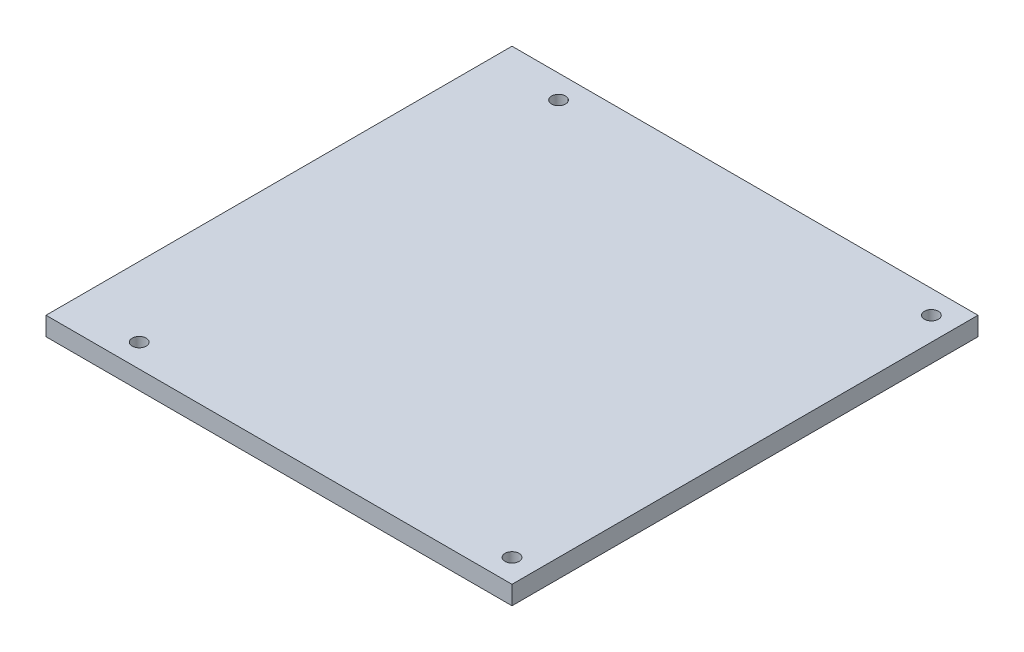
from build123d import *

# Parameters (mm, degrees)
CROQUIS1_W              = 100
CROQUIS1_H              = 100
SALIENTE_EXTRUIR1_DEPTH = 4
CROQUIS2_R              = 1.5
CORTAR_EXTRUIR1_DEPTH   = 142.477913471


with BuildPart() as part:
    # Croquis1 → Saliente-Extruir1 (new body)
    with BuildSketch(Plane(origin=(0, 0, 0), x_dir=(1, 0, 0), z_dir=(0, 1, 0))):
        with Locations((50, -50)):
            Rectangle(CROQUIS1_W, CROQUIS1_H)
    extrude(amount=SALIENTE_EXTRUIR1_DEPTH)

    # Croquis2 → Cortar-Extruir1 (cut, through all)
    with BuildSketch(Plane(origin=(0, 4, 0), x_dir=(1, 0, 0), z_dir=(0, 1, 0))):
        with Locations(Location((15, -5, 0), (0, 0, 270))):
            Circle(CROQUIS2_R)
        with Locations(Location((95, -5, 0), (0, 0, 270))):
            Circle(CROQUIS2_R)
        with Locations(Location((15, -95, 0), (0, 0, 270))):
            Circle(CROQUIS2_R)
        with Locations(Location((95, -95, 0), (0, 0, 270))):
            Circle(CROQUIS2_R)
    extrude(amount=-CORTAR_EXTRUIR1_DEPTH, mode=Mode.SUBTRACT)


solid = part.part
